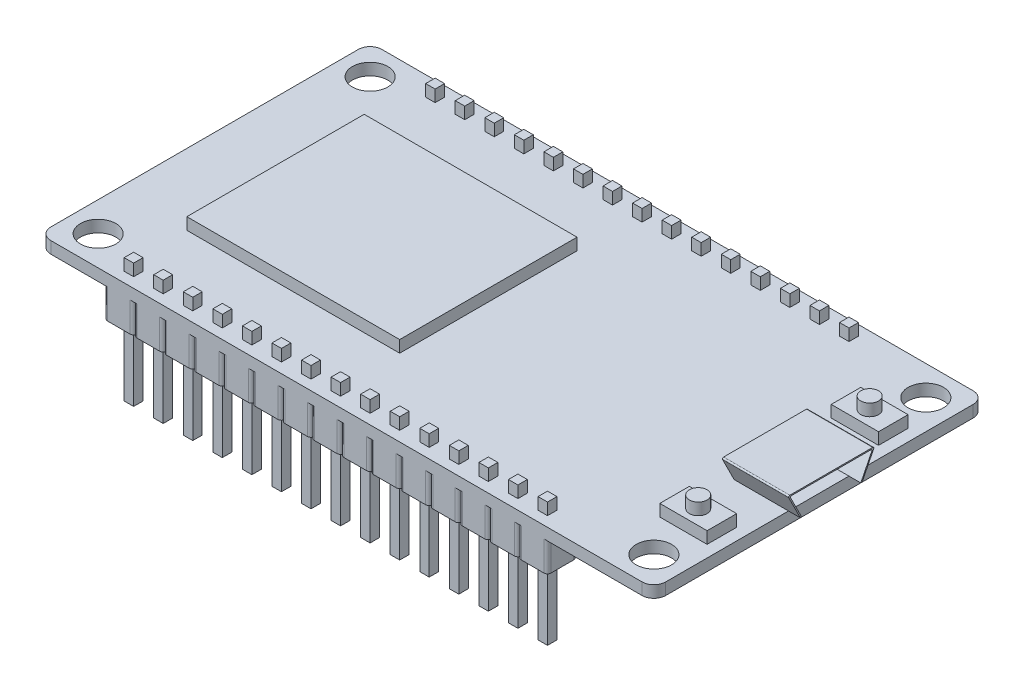
from build123d import *

# Parameters (mm, degrees)
SKETCH_1_W           = 52
SKETCH_1_H           = 28
SKETCH_1_R           = 1.5
EXTRUDE_1_DEPTH      = 1
FILLET_1_R           = 1
SKETCH_2_W           = 18
SKETCH_2_H           = 15
EXTRUDE_2_DEPTH      = 2
EXTRUDE_3_DEPTH      = 1
EXTRUDE_3_DEPTH_BACK = 4.5
EXTRUDE_4_DEPTH      = 0.1
FILLET_2_R           = 0.1
SKETCH_5_W           = 4
SKETCH_5_H           = 2.5
EXTRUDE_5_DEPTH      = 2
SKETCH_6_R           = 0.75
EXTRUDE_6_DEPTH      = 3
EXTRUDE_7_DEPTH      = 2
EXTRUDE_7_DEPTH_BACK = 8.5
SKETCH_7_W           = 0.8
SKETCH_7_H           = 0.8
SKETCH_8_W           = 0.8
SKETCH_8_H           = 0.8
EXTRUDE_9_DEPTH      = 2.5


with BuildPart() as part:
    # 草图1 → 凸台-拉伸1 (new body)
    with BuildSketch(Plane(origin=(0, 0, 0), x_dir=(1, 0, 0), z_dir=(0, 1, 0))):
        Rectangle(SKETCH_1_W, SKETCH_1_H)
        with Locations(Location((-23.5, -11.5, 0), (0, 0, 270))):
            Circle(SKETCH_1_R, mode=Mode.SUBTRACT)
        with Locations(Location((23.5, -11.5, 0), (0, 0, 90))):
            Circle(SKETCH_1_R, mode=Mode.SUBTRACT)
        with Locations(Location((23.5, 11.5, 0), (0, 0, 270))):
            Circle(SKETCH_1_R, mode=Mode.SUBTRACT)
        with Locations(Location((-23.5, 11.5, 0), (0, 0, 90))):
            Circle(SKETCH_1_R, mode=Mode.SUBTRACT)
    extrude(amount=EXTRUDE_1_DEPTH)

    # 圆角1
    fillet_1_edges = [part.edges().sort_by_distance(p)[0] for p in [
        (26, 0.5, -14),
        (26, 0.5, 14),
        (-26, 0.5, 14),
        (-26, 0.5, -14),
    ]]
    fillet(fillet_1_edges, radius=FILLET_1_R)

    # 草图2 → 凸台-拉伸2 (add)
    with BuildSketch(Plane(origin=(0, 0, 0), x_dir=(1, 0, 0), z_dir=(0, 1, 0))):
        with Locations((-11, 0)):
            Rectangle(SKETCH_2_W, SKETCH_2_H)
    extrude(amount=EXTRUDE_2_DEPTH)

    # 草图3 → 凸台-拉伸3 (add, two sides: drawn at the far end of the back side and taken through both)
    with BuildSketch(Plane(origin=(26, 0, 0), x_dir=(0, 0, -1), z_dir=(1, 0, 0)).offset(-EXTRUDE_3_DEPTH_BACK)):
        Polygon((2.5, 1), (3.5, 3), (-3.5, 3), (-2.5, 1), (-2.611803399, 1), (-3.661803399, 3.1), (3.661803399, 3.1), (2.611803399, 1), align=None)
    extrude(amount=EXTRUDE_3_DEPTH + EXTRUDE_3_DEPTH_BACK)

    # 草图4 → 凸台-拉伸4 (add)
    with BuildSketch(Plane(origin=(21.5, 0, 0), x_dir=(0, 0, -1), z_dir=(1, 0, 0))):
        Polygon((-3.661803399, 3.1), (-2.611803399, 1), (2.611803399, 1), (3.661803399, 3.1), align=None)
    extrude(amount=-EXTRUDE_4_DEPTH)

    # 圆角2
    fillet_2_edges = [part.edges().sort_by_distance(p)[0] for p in [
        (24.2, 3.1, 3.661803399),
        (24.2, 3.1, -3.661803399),
        (24.25, 3, -3.5),
        (24.25, 3, 3.5),
    ]]
    fillet(fillet_2_edges, radius=FILLET_2_R)

    # 草图5 → 凸台-拉伸5 (add)
    with BuildSketch(Plane(origin=(0, 0, 0), x_dir=(1, 0, 0), z_dir=(0, 1, 0))):
        with Locations((23, 7.25)):
            Rectangle(SKETCH_5_W, SKETCH_5_H)
        with Locations((23, -7.25)):
            Rectangle(SKETCH_5_W, SKETCH_5_H)
    extrude(amount=EXTRUDE_5_DEPTH)

    # 草图6 → 凸台-拉伸6 (add)
    with BuildSketch(Plane(origin=(0, 0, 0), x_dir=(1, 0, 0), z_dir=(0, 1, 0))):
        with Locations(Location((23, 7.25, 0), (0, 0, 270))):
            Circle(SKETCH_6_R)
        with Locations(Location((23, -7.25, 0), (0, 0, 90))):
            Circle(SKETCH_6_R)
    extrude(amount=EXTRUDE_6_DEPTH)

    # 草图7 → 凸台-拉伸7 (add, two sides: drawn at the far end of the back side and taken through both)
    with BuildSketch(Plane(origin=(0, 0, 0), x_dir=(1, 0, 0), z_dir=(0, 1, 0)).offset(-EXTRUDE_7_DEPTH_BACK)):
        with Locations((-19.25, 12.75)):
            Rectangle(SKETCH_7_W, SKETCH_7_H)
        with Locations((-19.25, -12.75)):
            Rectangle(SKETCH_7_W, SKETCH_7_H)
        with Locations((-16.75, 12.75)):
            Rectangle(SKETCH_7_W, SKETCH_7_H)
        with Locations((-16.75, -12.75)):
            Rectangle(SKETCH_7_W, SKETCH_7_H)
        with Locations((-14.25, 12.75)):
            Rectangle(SKETCH_7_W, SKETCH_7_H)
        with Locations((-14.25, -12.75)):
            Rectangle(SKETCH_7_W, SKETCH_7_H)
        with Locations((-11.75, 12.75)):
            Rectangle(SKETCH_7_W, SKETCH_7_H)
        with Locations((-11.75, -12.75)):
            Rectangle(SKETCH_7_W, SKETCH_7_H)
        with Locations((-9.25, 12.75)):
            Rectangle(SKETCH_7_W, SKETCH_7_H)
        with Locations((-9.25, -12.75)):
            Rectangle(SKETCH_7_W, SKETCH_7_H)
        with Locations((-6.75, 12.75)):
            Rectangle(SKETCH_7_W, SKETCH_7_H)
        with Locations((-6.75, -12.75)):
            Rectangle(SKETCH_7_W, SKETCH_7_H)
        with Locations((-4.25, 12.75)):
            Rectangle(SKETCH_7_W, SKETCH_7_H)
        with Locations((-4.25, -12.75)):
            Rectangle(SKETCH_7_W, SKETCH_7_H)
        with Locations((-1.75, 12.75)):
            Rectangle(SKETCH_7_W, SKETCH_7_H)
        with Locations((-1.75, -12.75)):
            Rectangle(SKETCH_7_W, SKETCH_7_H)
        with Locations((0.75, 12.75)):
            Rectangle(SKETCH_7_W, SKETCH_7_H)
        with Locations((0.75, -12.75)):
            Rectangle(SKETCH_7_W, SKETCH_7_H)
        with Locations((3.25, 12.75)):
            Rectangle(SKETCH_7_W, SKETCH_7_H)
        with Locations((3.25, -12.75)):
            Rectangle(SKETCH_7_W, SKETCH_7_H)
        with Locations((5.75, 12.75)):
            Rectangle(SKETCH_7_W, SKETCH_7_H)
        with Locations((5.75, -12.75)):
            Rectangle(SKETCH_7_W, SKETCH_7_H)
        with Locations((8.25, 12.75)):
            Rectangle(SKETCH_7_W, SKETCH_7_H)
        with Locations((8.25, -12.75)):
            Rectangle(SKETCH_7_W, SKETCH_7_H)
        with Locations((10.75, 12.75)):
            Rectangle(SKETCH_7_W, SKETCH_7_H)
        with Locations((10.75, -12.75)):
            Rectangle(SKETCH_7_W, SKETCH_7_H)
        with Locations((13.25, 12.75)):
            Rectangle(SKETCH_7_W, SKETCH_7_H)
        with Locations((13.25, -12.75)):
            Rectangle(SKETCH_7_W, SKETCH_7_H)
        with Locations((15.75, 12.75)):
            Rectangle(SKETCH_7_W, SKETCH_7_H)
        with Locations((15.75, -12.75)):
            Rectangle(SKETCH_7_W, SKETCH_7_H)
    extrude(amount=EXTRUDE_7_DEPTH + EXTRUDE_7_DEPTH_BACK)

    # 草图8 → 凸台-拉伸9 (add)
    # profile 1 of 2: a face of its own
    with BuildSketch(Plane(origin=(0, 0, 0), x_dir=(1, 0, 0), z_dir=(0, 1, 0))):
        with BuildLine():
            ThreePointArc((-20.2, 14), (-20.412132034, 13.912132034), (-20.5, 13.7))
            Line((-20.5, 13.7), (-20.5, 11.8))
            ThreePointArc((-20.5, 11.8), (-20.412132034, 11.587867966), (-20.2, 11.5))
            Line((-20.2, 11.5), (-18.3, 11.5))
            ThreePointArc((-18.3, 11.5), (-18.087867966, 11.587867966), (-18, 11.8))
            ThreePointArc((-18, 11.8), (-17.912132034, 11.587867966), (-17.7, 11.5))
            Line((-17.7, 11.5), (-15.8, 11.5))
            ThreePointArc((-15.8, 11.5), (-15.587867966, 11.587867966), (-15.5, 11.8))
            ThreePointArc((-15.5, 11.8), (-15.412132034, 11.587867966), (-15.2, 11.5))
            Line((-15.2, 11.5), (-13.3, 11.5))
            ThreePointArc((-13.3, 11.5), (-13.087867966, 11.587867966), (-13, 11.8))
            ThreePointArc((-13, 11.8), (-12.912132034, 11.587867966), (-12.7, 11.5))
            Line((-12.7, 11.5), (-10.8, 11.5))
            ThreePointArc((-10.8, 11.5), (-10.587867966, 11.587867966), (-10.5, 11.8))
            ThreePointArc((-10.5, 11.8), (-10.412132034, 11.587867966), (-10.2, 11.5))
            Line((-10.2, 11.5), (-8.3, 11.5))
            ThreePointArc((-8.3, 11.5), (-8.087867966, 11.587867966), (-8, 11.8))
            ThreePointArc((-8, 11.8), (-7.912132034, 11.587867966), (-7.7, 11.5))
            Line((-7.7, 11.5), (-5.8, 11.5))
            ThreePointArc((-5.8, 11.5), (-5.587867966, 11.587867966), (-5.5, 11.8))
            ThreePointArc((-5.5, 11.8), (-5.412132034, 11.587867966), (-5.2, 11.5))
            Line((-5.2, 11.5), (-3.3, 11.5))
            ThreePointArc((-3.3, 11.5), (-3.087867966, 11.587867966), (-3, 11.8))
            ThreePointArc((-3, 11.8), (-2.912132034, 11.587867966), (-2.7, 11.5))
            Line((-2.7, 11.5), (-0.8, 11.5))
            ThreePointArc((-0.8, 11.5), (-0.587867966, 11.587867966), (-0.5, 11.8))
            ThreePointArc((-0.5, 11.8), (-0.412132034, 11.587867966), (-0.2, 11.5))
            Line((-0.2, 11.5), (1.7, 11.5))
            ThreePointArc((1.7, 11.5), (1.912132034, 11.587867966), (2, 11.8))
            ThreePointArc((2, 11.8), (2.087867966, 11.587867966), (2.3, 11.5))
            Line((2.3, 11.5), (4.2, 11.5))
            ThreePointArc((4.2, 11.5), (4.412132034, 11.587867966), (4.5, 11.8))
            ThreePointArc((4.5, 11.8), (4.587867966, 11.587867966), (4.8, 11.5))
            Line((4.8, 11.5), (6.7, 11.5))
            ThreePointArc((6.7, 11.5), (6.912132034, 11.587867966), (7, 11.8))
            ThreePointArc((7, 11.8), (7.087867966, 11.587867966), (7.3, 11.5))
            Line((7.3, 11.5), (9.2, 11.5))
            ThreePointArc((9.2, 11.5), (9.412132034, 11.587867966), (9.5, 11.8))
            ThreePointArc((9.5, 11.8), (9.587867966, 11.587867966), (9.8, 11.5))
            Line((9.8, 11.5), (11.7, 11.5))
            ThreePointArc((11.7, 11.5), (11.912132034, 11.587867966), (12, 11.8))
            ThreePointArc((12, 11.8), (12.087867966, 11.587867966), (12.3, 11.5))
            Line((12.3, 11.5), (14.2, 11.5))
            ThreePointArc((14.2, 11.5), (14.412132034, 11.587867966), (14.5, 11.8))
            ThreePointArc((14.5, 11.8), (14.587867966, 11.587867966), (14.8, 11.5))
            Line((14.8, 11.5), (16.7, 11.5))
            ThreePointArc((16.7, 11.5), (16.912132034, 11.587867966), (17, 11.8))
            Line((17, 11.8), (17, 13.7))
            ThreePointArc((17, 13.7), (16.912132034, 13.912132034), (16.7, 14))
            Line((16.7, 14), (14.8, 14))
            ThreePointArc((14.8, 14), (14.587867966, 13.912132034), (14.5, 13.7))
            ThreePointArc((14.5, 13.7), (14.412132034, 13.912132034), (14.2, 14))
            Line((14.2, 14), (12.3, 14))
            ThreePointArc((12.3, 14), (12.087867966, 13.912132034), (12, 13.7))
            ThreePointArc((12, 13.7), (11.912132034, 13.912132034), (11.7, 14))
            Line((11.7, 14), (9.8, 14))
            ThreePointArc((9.8, 14), (9.587867966, 13.912132034), (9.5, 13.7))
            ThreePointArc((9.5, 13.7), (9.412132034, 13.912132034), (9.2, 14))
            Line((9.2, 14), (7.3, 14))
            ThreePointArc((7.3, 14), (7.087867966, 13.912132034), (7, 13.7))
            ThreePointArc((7, 13.7), (6.912132034, 13.912132034), (6.7, 14))
            Line((6.7, 14), (4.8, 14))
            ThreePointArc((4.8, 14), (4.587867966, 13.912132034), (4.5, 13.7))
            ThreePointArc((4.5, 13.7), (4.412132034, 13.912132034), (4.2, 14))
            Line((4.2, 14), (2.3, 14))
            ThreePointArc((2.3, 14), (2.087867966, 13.912132034), (2, 13.7))
            ThreePointArc((2, 13.7), (1.912132034, 13.912132034), (1.7, 14))
            Line((1.7, 14), (-0.2, 14))
            ThreePointArc((-0.2, 14), (-0.412132034, 13.912132034), (-0.5, 13.7))
            ThreePointArc((-0.5, 13.7), (-0.587867966, 13.912132034), (-0.8, 14))
            Line((-0.8, 14), (-2.7, 14))
            ThreePointArc((-2.7, 14), (-2.912132034, 13.912132034), (-3, 13.7))
            ThreePointArc((-3, 13.7), (-3.087867966, 13.912132034), (-3.3, 14))
            Line((-3.3, 14), (-5.2, 14))
            ThreePointArc((-5.2, 14), (-5.412132034, 13.912132034), (-5.5, 13.7))
            ThreePointArc((-5.5, 13.7), (-5.587867966, 13.912132034), (-5.8, 14))
            Line((-5.8, 14), (-7.7, 14))
            ThreePointArc((-7.7, 14), (-7.912132034, 13.912132034), (-8, 13.7))
            ThreePointArc((-8, 13.7), (-8.087867966, 13.912132034), (-8.3, 14))
            Line((-8.3, 14), (-10.2, 14))
            ThreePointArc((-10.2, 14), (-10.412132034, 13.912132034), (-10.5, 13.7))
            ThreePointArc((-10.5, 13.7), (-10.587867966, 13.912132034), (-10.8, 14))
            Line((-10.8, 14), (-12.7, 14))
            ThreePointArc((-12.7, 14), (-12.912132034, 13.912132034), (-13, 13.7))
            ThreePointArc((-13, 13.7), (-13.087867966, 13.912132034), (-13.3, 14))
            Line((-13.3, 14), (-15.2, 14))
            ThreePointArc((-15.2, 14), (-15.412132034, 13.912132034), (-15.5, 13.7))
            ThreePointArc((-15.5, 13.7), (-15.587867966, 13.912132034), (-15.8, 14))
            Line((-15.8, 14), (-17.7, 14))
            ThreePointArc((-17.7, 14), (-17.912132034, 13.912132034), (-18, 13.7))
            ThreePointArc((-18, 13.7), (-18.087867966, 13.912132034), (-18.3, 14))
            Line((-18.3, 14), (-20.2, 14))
        make_face()
        with Locations((-19.25, 12.75)):
            Rectangle(SKETCH_8_W, SKETCH_8_H, mode=Mode.SUBTRACT)
        with Locations((-16.75, 12.75)):
            Rectangle(SKETCH_8_W, SKETCH_8_H, mode=Mode.SUBTRACT)
        with Locations((-14.25, 12.75)):
            Rectangle(SKETCH_8_W, SKETCH_8_H, mode=Mode.SUBTRACT)
        with Locations((-11.75, 12.75)):
            Rectangle(SKETCH_8_W, SKETCH_8_H, mode=Mode.SUBTRACT)
        with Locations((-9.25, 12.75)):
            Rectangle(SKETCH_8_W, SKETCH_8_H, mode=Mode.SUBTRACT)
        with Locations((-6.75, 12.75)):
            Rectangle(SKETCH_8_W, SKETCH_8_H, mode=Mode.SUBTRACT)
        with Locations((-4.25, 12.75)):
            Rectangle(SKETCH_8_W, SKETCH_8_H, mode=Mode.SUBTRACT)
        with Locations((-1.75, 12.75)):
            Rectangle(SKETCH_8_W, SKETCH_8_H, mode=Mode.SUBTRACT)
        with Locations((0.75, 12.75)):
            Rectangle(SKETCH_8_W, SKETCH_8_H, mode=Mode.SUBTRACT)
        with Locations((3.25, 12.75)):
            Rectangle(SKETCH_8_W, SKETCH_8_H, mode=Mode.SUBTRACT)
        with Locations((5.75, 12.75)):
            Rectangle(SKETCH_8_W, SKETCH_8_H, mode=Mode.SUBTRACT)
        with Locations((8.25, 12.75)):
            Rectangle(SKETCH_8_W, SKETCH_8_H, mode=Mode.SUBTRACT)
        with Locations((10.75, 12.75)):
            Rectangle(SKETCH_8_W, SKETCH_8_H, mode=Mode.SUBTRACT)
        with Locations((13.25, 12.75)):
            Rectangle(SKETCH_8_W, SKETCH_8_H, mode=Mode.SUBTRACT)
        with Locations((15.75, 12.75)):
            Rectangle(SKETCH_8_W, SKETCH_8_H, mode=Mode.SUBTRACT)
    # profile 2 of 2: a face of its own
    with BuildSketch(Plane(origin=(0, 0, 0), x_dir=(1, 0, 0), z_dir=(0, 1, 0))):
        with BuildLine():
            ThreePointArc((-20.5, -13.7), (-20.412132034, -13.912132034), (-20.2, -14))
            Line((-20.2, -14), (-18.3, -14))
            ThreePointArc((-18.3, -14), (-18.087867966, -13.912132034), (-18, -13.7))
            ThreePointArc((-18, -13.7), (-17.912132034, -13.912132034), (-17.7, -14))
            Line((-17.7, -14), (-15.8, -14))
            ThreePointArc((-15.8, -14), (-15.587867966, -13.912132034), (-15.5, -13.7))
            ThreePointArc((-15.5, -13.7), (-15.412132034, -13.912132034), (-15.2, -14))
            Line((-15.2, -14), (-13.3, -14))
            ThreePointArc((-13.3, -14), (-13.087867966, -13.912132034), (-13, -13.7))
            ThreePointArc((-13, -13.7), (-12.912132034, -13.912132034), (-12.7, -14))
            Line((-12.7, -14), (-10.8, -14))
            ThreePointArc((-10.8, -14), (-10.587867966, -13.912132034), (-10.5, -13.7))
            ThreePointArc((-10.5, -13.7), (-10.412132034, -13.912132034), (-10.2, -14))
            Line((-10.2, -14), (-8.3, -14))
            ThreePointArc((-8.3, -14), (-8.087867966, -13.912132034), (-8, -13.7))
            ThreePointArc((-8, -13.7), (-7.912132034, -13.912132034), (-7.7, -14))
            Line((-7.7, -14), (-5.8, -14))
            ThreePointArc((-5.8, -14), (-5.587867966, -13.912132034), (-5.5, -13.7))
            ThreePointArc((-5.5, -13.7), (-5.412132034, -13.912132034), (-5.2, -14))
            Line((-5.2, -14), (-3.3, -14))
            ThreePointArc((-3.3, -14), (-3.087867966, -13.912132034), (-3, -13.7))
            ThreePointArc((-3, -13.7), (-2.912132034, -13.912132034), (-2.7, -14))
            Line((-2.7, -14), (-0.8, -14))
            ThreePointArc((-0.8, -14), (-0.587867966, -13.912132034), (-0.5, -13.7))
            ThreePointArc((-0.5, -13.7), (-0.412132034, -13.912132034), (-0.2, -14))
            Line((-0.2, -14), (1.7, -14))
            ThreePointArc((1.7, -14), (1.912132034, -13.912132034), (2, -13.7))
            ThreePointArc((2, -13.7), (2.087867966, -13.912132034), (2.3, -14))
            Line((2.3, -14), (4.2, -14))
            ThreePointArc((4.2, -14), (4.412132034, -13.912132034), (4.5, -13.7))
            ThreePointArc((4.5, -13.7), (4.587867966, -13.912132034), (4.8, -14))
            Line((4.8, -14), (6.7, -14))
            ThreePointArc((6.7, -14), (6.912132034, -13.912132034), (7, -13.7))
            ThreePointArc((7, -13.7), (7.087867966, -13.912132034), (7.3, -14))
            Line((7.3, -14), (9.2, -14))
            ThreePointArc((9.2, -14), (9.412132034, -13.912132034), (9.5, -13.7))
            ThreePointArc((9.5, -13.7), (9.587867966, -13.912132034), (9.8, -14))
            Line((9.8, -14), (11.7, -14))
            ThreePointArc((11.7, -14), (11.912132034, -13.912132034), (12, -13.7))
            ThreePointArc((12, -13.7), (12.087867966, -13.912132034), (12.3, -14))
            Line((12.3, -14), (14.2, -14))
            ThreePointArc((14.2, -14), (14.412132034, -13.912132034), (14.5, -13.7))
            ThreePointArc((14.5, -13.7), (14.587867966, -13.912132034), (14.8, -14))
            Line((14.8, -14), (16.7, -14))
            ThreePointArc((16.7, -14), (16.912132034, -13.912132034), (17, -13.7))
            Line((17, -13.7), (17, -11.8))
            ThreePointArc((17, -11.8), (16.912132034, -11.587867966), (16.7, -11.5))
            Line((16.7, -11.5), (14.8, -11.5))
            ThreePointArc((14.8, -11.5), (14.587867966, -11.587867966), (14.5, -11.8))
            ThreePointArc((14.5, -11.8), (14.412132034, -11.587867966), (14.2, -11.5))
            Line((14.2, -11.5), (12.3, -11.5))
            ThreePointArc((12.3, -11.5), (12.087867966, -11.587867966), (12, -11.8))
            ThreePointArc((12, -11.8), (11.912132034, -11.587867966), (11.7, -11.5))
            Line((11.7, -11.5), (9.8, -11.5))
            ThreePointArc((9.8, -11.5), (9.587867966, -11.587867966), (9.5, -11.8))
            ThreePointArc((9.5, -11.8), (9.412132034, -11.587867966), (9.2, -11.5))
            Line((9.2, -11.5), (7.3, -11.5))
            ThreePointArc((7.3, -11.5), (7.087867966, -11.587867966), (7, -11.8))
            ThreePointArc((7, -11.8), (6.912132034, -11.587867966), (6.7, -11.5))
            Line((6.7, -11.5), (4.8, -11.5))
            ThreePointArc((4.8, -11.5), (4.587867966, -11.587867966), (4.5, -11.8))
            ThreePointArc((4.5, -11.8), (4.412132034, -11.587867966), (4.2, -11.5))
            Line((4.2, -11.5), (2.3, -11.5))
            ThreePointArc((2.3, -11.5), (2.087867966, -11.587867966), (2, -11.8))
            ThreePointArc((2, -11.8), (1.912132034, -11.587867966), (1.7, -11.5))
            Line((1.7, -11.5), (-0.2, -11.5))
            ThreePointArc((-0.2, -11.5), (-0.412132034, -11.587867966), (-0.5, -11.8))
            ThreePointArc((-0.5, -11.8), (-0.587867966, -11.587867966), (-0.8, -11.5))
            Line((-0.8, -11.5), (-2.7, -11.5))
            ThreePointArc((-2.7, -11.5), (-2.912132034, -11.587867966), (-3, -11.8))
            ThreePointArc((-3, -11.8), (-3.087867966, -11.587867966), (-3.3, -11.5))
            Line((-3.3, -11.5), (-5.2, -11.5))
            ThreePointArc((-5.2, -11.5), (-5.412132034, -11.587867966), (-5.5, -11.8))
            ThreePointArc((-5.5, -11.8), (-5.587867966, -11.587867966), (-5.8, -11.5))
            Line((-5.8, -11.5), (-7.7, -11.5))
            ThreePointArc((-7.7, -11.5), (-7.912132034, -11.587867966), (-8, -11.8))
            ThreePointArc((-8, -11.8), (-8.087867966, -11.587867966), (-8.3, -11.5))
            Line((-8.3, -11.5), (-10.2, -11.5))
            ThreePointArc((-10.2, -11.5), (-10.412132034, -11.587867966), (-10.5, -11.8))
            ThreePointArc((-10.5, -11.8), (-10.587867966, -11.587867966), (-10.8, -11.5))
            Line((-10.8, -11.5), (-12.7, -11.5))
            ThreePointArc((-12.7, -11.5), (-12.912132034, -11.587867966), (-13, -11.8))
            ThreePointArc((-13, -11.8), (-13.087867966, -11.587867966), (-13.3, -11.5))
            Line((-13.3, -11.5), (-15.2, -11.5))
            ThreePointArc((-15.2, -11.5), (-15.412132034, -11.587867966), (-15.5, -11.8))
            ThreePointArc((-15.5, -11.8), (-15.587867966, -11.587867966), (-15.8, -11.5))
            Line((-15.8, -11.5), (-17.7, -11.5))
            ThreePointArc((-17.7, -11.5), (-17.912132034, -11.587867966), (-18, -11.8))
            ThreePointArc((-18, -11.8), (-18.087867966, -11.587867966), (-18.3, -11.5))
            Line((-18.3, -11.5), (-20.2, -11.5))
            ThreePointArc((-20.2, -11.5), (-20.412132034, -11.587867966), (-20.5, -11.8))
            Line((-20.5, -11.8), (-20.5, -13.7))
        make_face()
        with Locations((-19.25, -12.75)):
            Rectangle(SKETCH_8_W, SKETCH_8_H, mode=Mode.SUBTRACT)
        with Locations((-16.75, -12.75)):
            Rectangle(SKETCH_8_W, SKETCH_8_H, mode=Mode.SUBTRACT)
        with Locations((-14.25, -12.75)):
            Rectangle(SKETCH_8_W, SKETCH_8_H, mode=Mode.SUBTRACT)
        with Locations((-11.75, -12.75)):
            Rectangle(SKETCH_8_W, SKETCH_8_H, mode=Mode.SUBTRACT)
        with Locations((-9.25, -12.75)):
            Rectangle(SKETCH_8_W, SKETCH_8_H, mode=Mode.SUBTRACT)
        with Locations((-6.75, -12.75)):
            Rectangle(SKETCH_8_W, SKETCH_8_H, mode=Mode.SUBTRACT)
        with Locations((-4.25, -12.75)):
            Rectangle(SKETCH_8_W, SKETCH_8_H, mode=Mode.SUBTRACT)
        with Locations((-1.75, -12.75)):
            Rectangle(SKETCH_8_W, SKETCH_8_H, mode=Mode.SUBTRACT)
        with Locations((0.75, -12.75)):
            Rectangle(SKETCH_8_W, SKETCH_8_H, mode=Mode.SUBTRACT)
        with Locations((3.25, -12.75)):
            Rectangle(SKETCH_8_W, SKETCH_8_H, mode=Mode.SUBTRACT)
        with Locations((5.75, -12.75)):
            Rectangle(SKETCH_8_W, SKETCH_8_H, mode=Mode.SUBTRACT)
        with Locations((8.25, -12.75)):
            Rectangle(SKETCH_8_W, SKETCH_8_H, mode=Mode.SUBTRACT)
        with Locations((10.75, -12.75)):
            Rectangle(SKETCH_8_W, SKETCH_8_H, mode=Mode.SUBTRACT)
        with Locations((13.25, -12.75)):
            Rectangle(SKETCH_8_W, SKETCH_8_H, mode=Mode.SUBTRACT)
        with Locations((15.75, -12.75)):
            Rectangle(SKETCH_8_W, SKETCH_8_H, mode=Mode.SUBTRACT)
    extrude(amount=-EXTRUDE_9_DEPTH)


solid = part.part
